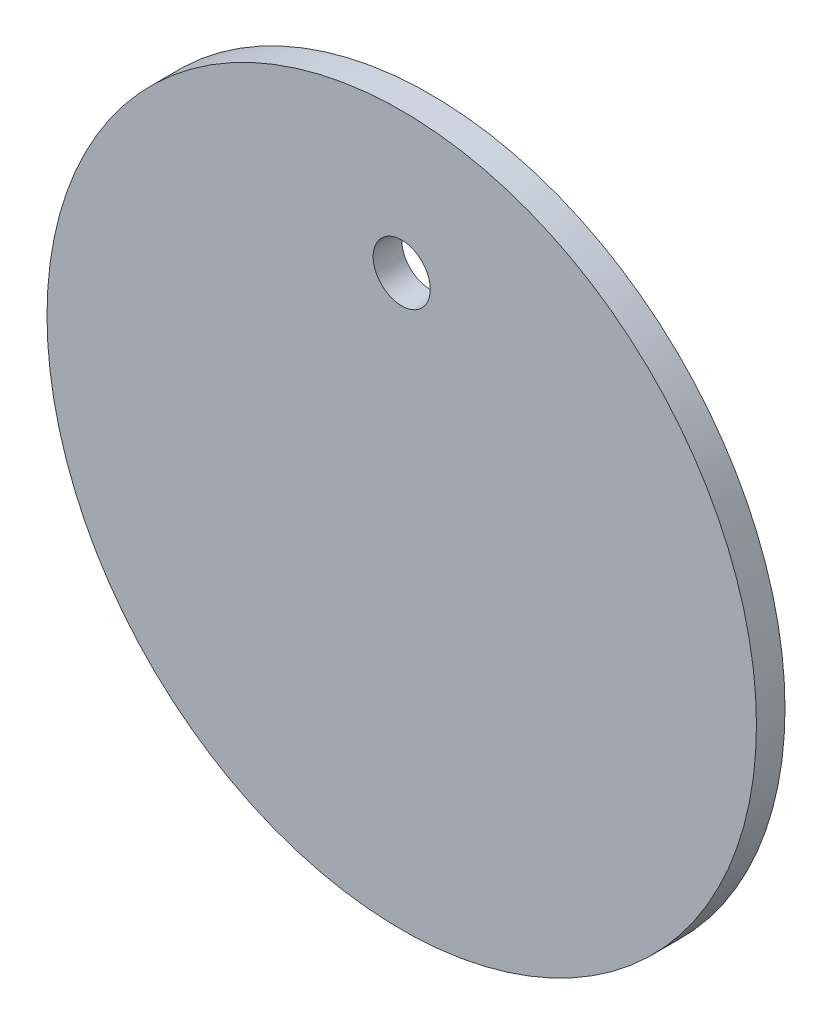
from build123d import *

# Parameters (mm, degrees)
SKETCH2_R           = 24.85
BOSS_EXTRUDE1_DEPTH = 2
SKETCH3_R           = 2
CUT_EXTRUDE2_DEPTH  = 2


with BuildPart() as part:
    # Sketch2 → Boss-Extrude1 (new body)
    with BuildSketch(Plane.XY):
        Circle(SKETCH2_R)
    extrude(amount=BOSS_EXTRUDE1_DEPTH)

    # Sketch3 → Cut-Extrude2 (cut)
    with BuildSketch(Plane.XY.offset(2)):
        with Locations((0, 15)):
            Circle(SKETCH3_R)
    extrude(amount=-CUT_EXTRUDE2_DEPTH, mode=Mode.SUBTRACT)


solid = part.part
